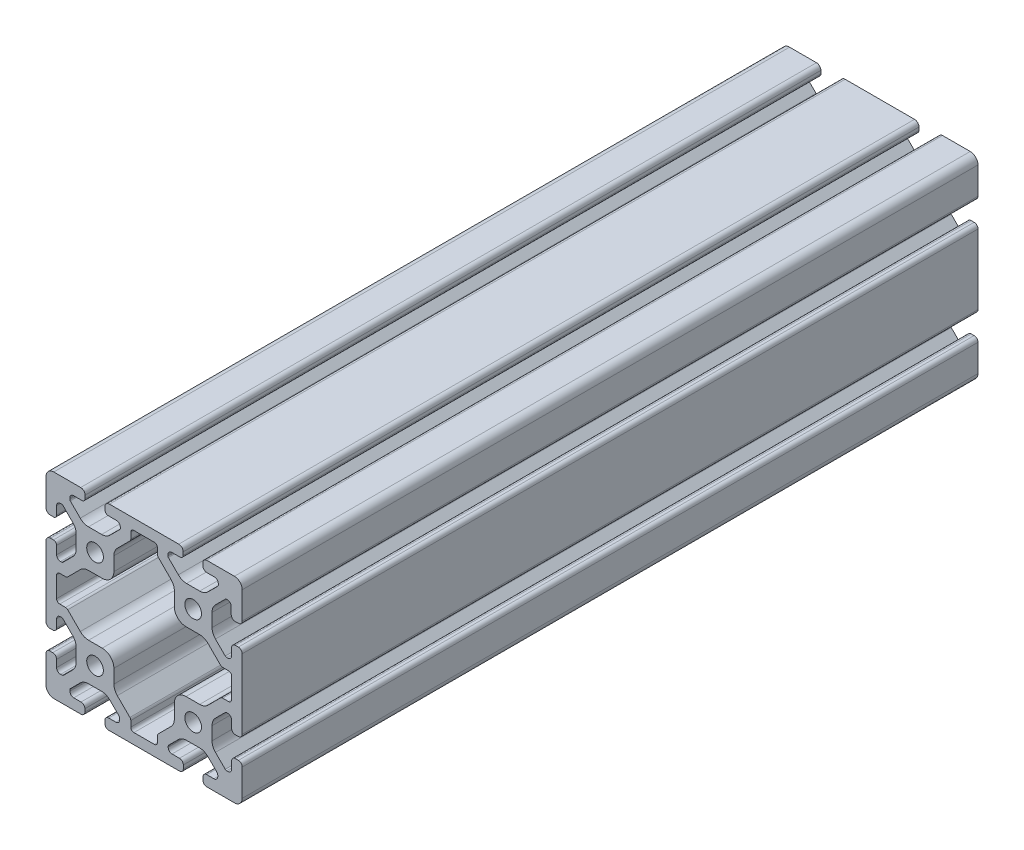
from build123d import *

# Parameters (mm, degrees)
SKETCH1_R      = 3.4
EXTRUDE1_DEPTH = 300


with BuildPart() as part:
    # Sketch1 → Extrude1 (new body)
    with BuildSketch(Plane.XY):
        with BuildLine():
            Line((29.091242789, 26.036541495), (33.082657296, 30.027956002))
            ThreePointArc((33.082657296, 30.027956002), (33.329219041, 30.192703293), (33.62005845, 30.250554848))
            Line((33.62005845, 30.250554848), (33.955571436, 30.250554848))
            ThreePointArc((33.955571436, 30.250554848), (35.065729082, 29.790712494), (35.525571436, 28.680554848))
            Line((35.525571436, 28.680554848), (35.525571436, 25.777866899))
            ThreePointArc((35.525571436, 25.777866899), (35.985413789, 24.667709253), (37.095571436, 24.207866899))
            Line((37.095571436, 24.207866899), (38.43, 24.207866899))
            ThreePointArc((38.43, 24.207866899), (39.540157646, 24.667709253), (40, 25.777866899))
            Line((40, 25.777866899), (40, 32.933852749))
            Line((40, 32.933852749), (40, 36.83))
            ThreePointArc((40, 36.83), (39.071528496, 39.071528496), (36.83, 40))
            Line((36.83, 40), (25.540851266, 40))
            ThreePointArc((25.540851266, 40), (24.43069362, 39.540157646), (23.970851266, 38.43))
            Line((23.970851266, 38.43), (23.970851266, 37.249043598))
            ThreePointArc((23.970851266, 37.249043598), (24.43069362, 36.138885952), (25.540851266, 35.679043598))
            Line((25.540851266, 35.679043598), (28.625762638, 35.679043598))
            ThreePointArc((28.625762638, 35.679043598), (29.77116849, 35.239363487), (30.250554848, 34.11))
            Line((30.250554848, 34.11), (30.250554848, 33.62005845))
            ThreePointArc((30.250554848, 33.62005845), (30.192703293, 33.329219041), (30.027956002, 33.082657296))
            Line((30.027956002, 33.082657296), (26.036541495, 29.091242789))
            ThreePointArc((26.036541495, 29.091242789), (24.495530588, 28.061572221), (22.677784284, 27.7))
            Line((22.677784284, 27.7), (17.322215716, 27.7))
            ThreePointArc((17.322215716, 27.7), (15.504469412, 28.061572221), (13.963458505, 29.091242789))
            Line((13.963458505, 29.091242789), (9.90393336, 33.150767934))
            ThreePointArc((9.90393336, 33.150767934), (9.764102181, 33.360040084), (9.715, 33.606893415))
            Line((9.715, 33.606893415), (9.715, 34.096834965))
            ThreePointArc((9.715, 34.096834965), (10.178698303, 35.216301697), (11.298165035, 35.68))
            Line((11.298165035, 35.68), (14.642754087, 35.68))
            ThreePointArc((14.642754087, 35.68), (15.560045469, 36.059954531), (15.94, 36.977245913))
            Line((15.94, 36.977245913), (15.94, 38.194841282))
            ThreePointArc((15.94, 38.194841282), (15.411281253, 39.471281253), (14.134841282, 40))
            Line((14.134841282, 40), (6.984433948, 40))
            Line((6.984433948, 40), (-6.984433948, 40))
            Line((-6.984433948, 40), (-14.134841282, 40))
            ThreePointArc((-14.134841282, 40), (-15.411281253, 39.471281253), (-15.94, 38.194841282))
            Line((-15.94, 38.194841282), (-15.94, 36.977245913))
            ThreePointArc((-15.94, 36.977245913), (-15.560045469, 36.059954531), (-14.642754087, 35.68))
            Line((-14.642754087, 35.68), (-11.298165035, 35.68))
            ThreePointArc((-11.298165035, 35.68), (-10.178698303, 35.216301697), (-9.715, 34.096834965))
            Line((-9.715, 34.096834965), (-9.715, 33.606893415))
            ThreePointArc((-9.715, 33.606893415), (-9.764102181, 33.360040084), (-9.90393336, 33.150767934))
            Line((-9.90393336, 33.150767934), (-13.963458505, 29.091242789))
            ThreePointArc((-13.963458505, 29.091242789), (-15.504469412, 28.061572221), (-17.322215716, 27.7))
            Line((-17.322215716, 27.7), (-22.677784284, 27.7))
            ThreePointArc((-22.677784284, 27.7), (-24.495530588, 28.061572221), (-26.036541495, 29.091242789))
            Line((-26.036541495, 29.091242789), (-30.09606664, 33.150767934))
            ThreePointArc((-30.09606664, 33.150767934), (-30.235897819, 33.360040084), (-30.285, 33.606893415))
            Line((-30.285, 33.606893415), (-30.285, 34.096834965))
            ThreePointArc((-30.285, 34.096834965), (-29.821301697, 35.216301697), (-28.701834965, 35.68))
            Line((-28.701834965, 35.68), (-25.357245913, 35.68))
            ThreePointArc((-25.357245913, 35.68), (-24.439954531, 36.059954531), (-24.06, 36.977245913))
            Line((-24.06, 36.977245913), (-24.06, 38.194841282))
            ThreePointArc((-24.06, 38.194841282), (-24.588718747, 39.471281253), (-25.865158718, 40))
            Line((-25.865158718, 40), (-33.031395847, 40))
            Line((-33.031395847, 40), (-36.83, 40))
            ThreePointArc((-36.83, 40), (-39.071528496, 39.071528496), (-40, 36.83))
            Line((-40, 36.83), (-40, 33.318079463))
            Line((-40, 33.318079463), (-40, 25.865158718))
            ThreePointArc((-40, 25.865158718), (-39.471281253, 24.588718747), (-38.194841282, 24.06))
            Line((-38.194841282, 24.06), (-36.977245913, 24.06))
            ThreePointArc((-36.977245913, 24.06), (-36.059954531, 24.439954531), (-35.68, 25.357245913))
            Line((-35.68, 25.357245913), (-35.68, 28.680554848))
            ThreePointArc((-35.68, 28.680554848), (-35.220157646, 29.790712494), (-34.11, 30.250554848))
            Line((-34.11, 30.250554848), (-33.62005845, 30.250554848))
            ThreePointArc((-33.62005845, 30.250554848), (-33.329219041, 30.192703293), (-33.082657296, 30.027956002))
            Line((-33.082657296, 30.027956002), (-29.091242789, 26.036541495))
            ThreePointArc((-29.091242789, 26.036541495), (-28.061572221, 24.495530588), (-27.7, 22.677784284))
            Line((-27.7, 22.677784284), (-27.7, 17.322215716))
            ThreePointArc((-27.7, 17.322215716), (-28.061572221, 15.504469412), (-29.091242789, 13.963458505))
            Line((-29.091242789, 13.963458505), (-33.082657296, 9.972043998))
            ThreePointArc((-33.082657296, 9.972043998), (-33.329219041, 9.807296707), (-33.62005845, 9.749445152))
            Line((-33.62005845, 9.749445152), (-34.11, 9.749445152))
            ThreePointArc((-34.11, 9.749445152), (-35.220157646, 10.209287506), (-35.68, 11.319445152))
            Line((-35.68, 11.319445152), (-35.68, 14.642754087))
            ThreePointArc((-35.68, 14.642754087), (-36.059954531, 15.560045469), (-36.977245913, 15.94))
            Line((-36.977245913, 15.94), (-38.194841282, 15.94))
            ThreePointArc((-38.194841282, 15.94), (-39.471281253, 15.411281253), (-40, 14.134841282))
            Line((-40, 14.134841282), (-40, 7.016888977))
            Line((-40, 7.016888977), (-40, -7.016888977))
            Line((-40, -7.016888977), (-40, -14.447338303))
            ThreePointArc((-40, -14.447338303), (-39.540157646, -15.557495949), (-38.43, -16.017338303))
            Line((-38.43, -16.017338303), (-37.25, -16.017338303))
            ThreePointArc((-37.25, -16.017338303), (-36.139842354, -15.557495949), (-35.68, -14.447338303))
            Line((-35.68, -14.447338303), (-35.68, -11.319445152))
            ThreePointArc((-35.68, -11.319445152), (-35.220157646, -10.209287506), (-34.11, -9.749445152))
            Line((-34.11, -9.749445152), (-33.62005845, -9.749445152))
            ThreePointArc((-33.62005845, -9.749445152), (-33.329219041, -9.807296707), (-33.082657296, -9.972043998))
            Line((-33.082657296, -9.972043998), (-29.091242789, -13.963458505))
            ThreePointArc((-29.091242789, -13.963458505), (-28.061572221, -15.504469412), (-27.7, -17.322215716))
            Line((-27.7, -17.322215716), (-27.7, -22.677784284))
            ThreePointArc((-27.7, -22.677784284), (-28.061572221, -24.495530588), (-29.091242789, -26.036541495))
            Line((-29.091242789, -26.036541495), (-32.871776968, -29.817075674))
            ThreePointArc((-32.871776968, -29.817075674), (-33.10612883, -29.976640176), (-33.382654504, -30.039211548))
            Line((-33.382654504, -30.039211548), (-34.05520779, -30.062697627))
            ThreePointArc((-34.05520779, -30.062697627), (-35.200613642, -29.623017515), (-35.68, -28.493654028))
            Line((-35.68, -28.493654028), (-35.68, -25.59096608))
            ThreePointArc((-35.68, -25.59096608), (-36.139842354, -24.480808433), (-37.25, -24.02096608))
            Line((-37.25, -24.02096608), (-38.43, -24.02096608))
            ThreePointArc((-38.43, -24.02096608), (-39.540157646, -24.480808433), (-40, -25.59096608))
            Line((-40, -25.59096608), (-40, -33.019082273))
            Line((-40, -33.019082273), (-40, -36.83))
            ThreePointArc((-40, -36.83), (-39.071528496, -39.071528496), (-36.83, -40))
            Line((-36.83, -40), (-33, -40))
            Line((-33, -40), (-25.72307469, -40))
            ThreePointArc((-25.72307469, -40), (-24.612917043, -39.540157646), (-24.15307469, -38.43))
            Line((-24.15307469, -38.43), (-24.15307469, -37.25))
            ThreePointArc((-24.15307469, -37.25), (-24.612917043, -36.139842354), (-25.72307469, -35.68))
            Line((-25.72307469, -35.68), (-28.680554848, -35.68))
            ThreePointArc((-28.680554848, -35.68), (-29.790712494, -35.220157646), (-30.250554848, -34.11))
            Line((-30.250554848, -34.11), (-30.250554848, -33.62005845))
            ThreePointArc((-30.250554848, -33.62005845), (-30.192703293, -33.329219041), (-30.027956002, -33.082657296))
            Line((-30.027956002, -33.082657296), (-26.036541495, -29.091242789))
            ThreePointArc((-26.036541495, -29.091242789), (-24.495530588, -28.061572221), (-22.677784284, -27.7))
            Line((-22.677784284, -27.7), (-17.322215716, -27.7))
            ThreePointArc((-17.322215716, -27.7), (-15.504469412, -28.061572221), (-13.963458505, -29.091242789))
            Line((-13.963458505, -29.091242789), (-10.203784275, -32.85091702))
            ThreePointArc((-10.203784275, -32.85091702), (-10.044219772, -33.085268882), (-9.9816484, -33.361794556))
            Line((-9.9816484, -33.361794556), (-9.957433876, -34.05520779))
            ThreePointArc((-9.957433876, -34.05520779), (-10.397113988, -35.200613642), (-11.526477474, -35.68))
            Line((-11.526477474, -35.68), (-14.429165423, -35.68))
            ThreePointArc((-14.429165423, -35.68), (-15.539323069, -36.139842354), (-15.999165423, -37.25))
            Line((-15.999165423, -37.25), (-15.999165423, -38.43))
            ThreePointArc((-15.999165423, -38.43), (-15.539323069, -39.540157646), (-14.429165423, -40))
            Line((-14.429165423, -40), (-6.998716097, -40))
            Line((-6.998716097, -40), (6.998716097, -40))
            Line((6.998716097, -40), (14.424638994, -40))
            ThreePointArc((14.424638994, -40), (15.53479664, -39.540157646), (15.994638994, -38.43))
            Line((15.994638994, -38.43), (15.994638994, -37.032644306))
            ThreePointArc((15.994638994, -37.032644306), (15.53479664, -35.922486659), (14.424638994, -35.462644306))
            Line((14.424638994, -35.462644306), (11.382372282, -35.462644306))
            ThreePointArc((11.382372282, -35.462644306), (10.272214636, -35.002801952), (9.812372282, -33.892644306))
            Line((9.812372282, -33.892644306), (9.812372282, -33.55713132))
            ThreePointArc((9.812372282, -33.55713132), (9.870223837, -33.266291912), (10.034971128, -33.019730166))
            Line((10.034971128, -33.019730166), (13.963458505, -29.091242789))
            ThreePointArc((13.963458505, -29.091242789), (15.504469412, -28.061572221), (17.322215716, -27.7))
            Line((17.322215716, -27.7), (22.677784284, -27.7))
            ThreePointArc((22.677784284, -27.7), (24.495530588, -28.061572221), (26.036541495, -29.091242789))
            Line((26.036541495, -29.091242789), (29.794925243, -32.849626538))
            ThreePointArc((29.794925243, -32.849626538), (29.954489746, -33.083978399), (30.017061118, -33.360504074))
            Line((30.017061118, -33.360504074), (30.041320706, -34.05520779))
            ThreePointArc((30.041320706, -34.05520779), (29.601640594, -35.200613642), (28.472277108, -35.68))
            Line((28.472277108, -35.68), (25.569589159, -35.68))
            ThreePointArc((25.569589159, -35.68), (24.459431513, -36.139842354), (23.999589159, -37.25))
            Line((23.999589159, -37.25), (23.999589159, -38.43))
            ThreePointArc((23.999589159, -38.43), (24.459431513, -39.540157646), (25.569589159, -40))
            Line((25.569589159, -40), (32.999849358, -40))
            Line((32.999849358, -40), (36.83, -40))
            ThreePointArc((36.83, -40), (39.071528496, -39.071528496), (40, -36.83))
            Line((40, -36.83), (40, -33.025941835))
            Line((40, -33.025941835), (40, -25.777866899))
            ThreePointArc((40, -25.777866899), (39.540157646, -24.667709253), (38.43, -24.207866899))
            Line((38.43, -24.207866899), (37.25, -24.207866899))
            ThreePointArc((37.25, -24.207866899), (36.139842354, -24.667709253), (35.68, -25.777866899))
            Line((35.68, -25.777866899), (35.68, -28.680554848))
            ThreePointArc((35.68, -28.680554848), (35.220157646, -29.790712494), (34.11, -30.250554848))
            Line((34.11, -30.250554848), (33.62005845, -30.250554848))
            ThreePointArc((33.62005845, -30.250554848), (33.329219041, -30.192703293), (33.082657296, -30.027956002))
            Line((33.082657296, -30.027956002), (29.091242789, -26.036541495))
            ThreePointArc((29.091242789, -26.036541495), (28.061572221, -24.495530588), (27.7, -22.677784284))
            Line((27.7, -22.677784284), (27.7, -17.322215716))
            ThreePointArc((27.7, -17.322215716), (28.061572221, -15.504469412), (29.091242789, -13.963458505))
            Line((29.091242789, -13.963458505), (33.082657296, -9.972043998))
            ThreePointArc((33.082657296, -9.972043998), (33.329219041, -9.807296707), (33.62005845, -9.749445152))
            Line((33.62005845, -9.749445152), (34.11, -9.749445152))
            ThreePointArc((34.11, -9.749445152), (35.220157646, -10.209287506), (35.68, -11.319445152))
            Line((35.68, -11.319445152), (35.68, -14.222133101))
            ThreePointArc((35.68, -14.222133101), (36.139842354, -15.332290747), (37.25, -15.792133101))
            Line((37.25, -15.792133101), (38.43, -15.792133101))
            ThreePointArc((38.43, -15.792133101), (39.540157646, -15.332290747), (40, -14.222133101))
            Line((40, -14.222133101), (40, -7.021415406))
            Line((40, -7.021415406), (40, 7.021415406))
            Line((40, 7.021415406), (40, 14.222133101))
            ThreePointArc((40, 14.222133101), (39.540157646, 15.332290747), (38.43, 15.792133101))
            Line((38.43, 15.792133101), (37.25, 15.792133101))
            ThreePointArc((37.25, 15.792133101), (36.139842354, 15.332290747), (35.68, 14.222133101))
            Line((35.68, 14.222133101), (35.68, 11.319445152))
            ThreePointArc((35.68, 11.319445152), (35.220157646, 10.209287506), (34.11, 9.749445152))
            Line((34.11, 9.749445152), (33.62005845, 9.749445152))
            ThreePointArc((33.62005845, 9.749445152), (33.329219041, 9.807296707), (33.082657296, 9.972043998))
            Line((33.082657296, 9.972043998), (29.091242789, 13.963458505))
            ThreePointArc((29.091242789, 13.963458505), (28.061572221, 15.504469412), (27.7, 17.322215716))
            Line((27.7, 17.322215716), (27.7, 22.677784284))
            ThreePointArc((27.7, 22.677784284), (28.061572221, 24.495530588), (29.091242789, 26.036541495))
        make_face()
        with Locations((-20, 20)):
            Circle(SKETCH1_R, mode=Mode.SUBTRACT)
        with Locations((20, 20)):
            Circle(SKETCH1_R, mode=Mode.SUBTRACT)
        with Locations((20, -20)):
            Circle(SKETCH1_R, mode=Mode.SUBTRACT)
        with Locations((-20, -20)):
            Circle(SKETCH1_R, mode=Mode.SUBTRACT)
        with BuildLine():
            Line((17.07, 12.32), (22.657784284, 12.32))
            ThreePointArc((22.657784284, 12.32), (24.475530588, 11.958427779), (26.016541495, 10.928757211))
            Line((26.016541495, 10.928757211), (31.143879165, 5.80141954))
            ThreePointArc((31.143879165, 5.80141954), (31.555896818, 5.526118146), (32.041904777, 5.429445152))
            Line((32.041904777, 5.429445152), (34.41, 5.429445152))
            ThreePointArc((34.41, 5.429445152), (35.308025612, 5.057470764), (35.68, 4.159445152))
            Line((35.68, 4.159445152), (35.68, -4.159445152))
            ThreePointArc((35.68, -4.159445152), (35.308025612, -5.057470764), (34.41, -5.429445152))
            Line((34.41, -5.429445152), (32.041904777, -5.429445152))
            ThreePointArc((32.041904777, -5.429445152), (31.555896818, -5.526118146), (31.143879165, -5.80141954))
            Line((31.143879165, -5.80141954), (26.016541495, -10.928757211))
            ThreePointArc((26.016541495, -10.928757211), (24.475530588, -11.958427779), (22.657784284, -12.32))
            Line((22.657784284, -12.32), (17.07, -12.32))
            ThreePointArc((17.07, -12.32), (13.711242789, -13.711242789), (12.32, -17.07))
            Line((12.32, -17.07), (12.32, -22.657784284))
            ThreePointArc((12.32, -22.657784284), (11.958427779, -24.475530588), (10.928757211, -26.016541495))
            Line((10.928757211, -26.016541495), (5.80141954, -31.143879165))
            ThreePointArc((5.80141954, -31.143879165), (5.526118146, -31.555896818), (5.429445152, -32.041904777))
            Line((5.429445152, -32.041904777), (5.429445152, -34.41))
            ThreePointArc((5.429445152, -34.41), (5.057470764, -35.308025612), (4.159445152, -35.68))
            Line((4.159445152, -35.68), (-4.159445152, -35.68))
            ThreePointArc((-4.159445152, -35.68), (-5.057470764, -35.308025612), (-5.429445152, -34.41))
            Line((-5.429445152, -34.41), (-5.429445152, -32.041904777))
            ThreePointArc((-5.429445152, -32.041904777), (-5.526118146, -31.555896818), (-5.80141954, -31.143879165))
            Line((-5.80141954, -31.143879165), (-10.928757211, -26.016541495))
            ThreePointArc((-10.928757211, -26.016541495), (-11.958427779, -24.475530588), (-12.32, -22.657784284))
            Line((-12.32, -22.657784284), (-12.32, -17.07))
            ThreePointArc((-12.32, -17.07), (-13.711242789, -13.711242789), (-17.07, -12.32))
            Line((-17.07, -12.32), (-22.657784284, -12.32))
            ThreePointArc((-22.657784284, -12.32), (-24.475530588, -11.958427779), (-26.016541495, -10.928757211))
            Line((-26.016541495, -10.928757211), (-31.143879165, -5.80141954))
            ThreePointArc((-31.143879165, -5.80141954), (-31.555896818, -5.526118146), (-32.041904777, -5.429445152))
            Line((-32.041904777, -5.429445152), (-34.41, -5.429445152))
            ThreePointArc((-34.41, -5.429445152), (-35.308025612, -5.057470764), (-35.68, -4.159445152))
            Line((-35.68, -4.159445152), (-35.68, 4.159445152))
            ThreePointArc((-35.68, 4.159445152), (-35.308025612, 5.057470764), (-34.41, 5.429445152))
            Line((-34.41, 5.429445152), (-32.041904777, 5.429445152))
            ThreePointArc((-32.041904777, 5.429445152), (-31.555896818, 5.526118146), (-31.143879165, 5.80141954))
            Line((-31.143879165, 5.80141954), (-26.016541495, 10.928757211))
            ThreePointArc((-26.016541495, 10.928757211), (-24.475530588, 11.958427779), (-22.657784284, 12.32))
            Line((-22.657784284, 12.32), (-17.07, 12.32))
            ThreePointArc((-17.07, 12.32), (-13.711242789, 13.711242789), (-12.32, 17.07))
            Line((-12.32, 17.07), (-12.32, 22.657784284))
            ThreePointArc((-12.32, 22.657784284), (-11.958427779, 24.475530588), (-10.928757211, 26.016541495))
            Line((-10.928757211, 26.016541495), (-5.80141954, 31.143879165))
            ThreePointArc((-5.80141954, 31.143879165), (-5.526118146, 31.555896818), (-5.429445152, 32.041904777))
            Line((-5.429445152, 32.041904777), (-5.429445152, 34.41))
            ThreePointArc((-5.429445152, 34.41), (-5.057470764, 35.308025612), (-4.159445152, 35.68))
            Line((-4.159445152, 35.68), (4.159445152, 35.68))
            ThreePointArc((4.159445152, 35.68), (5.057470764, 35.308025612), (5.429445152, 34.41))
            Line((5.429445152, 34.41), (5.429445152, 32.041904777))
            ThreePointArc((5.429445152, 32.041904777), (5.526118146, 31.555896818), (5.80141954, 31.143879165))
            Line((5.80141954, 31.143879165), (10.928757211, 26.016541495))
            ThreePointArc((10.928757211, 26.016541495), (11.958427779, 24.475530588), (12.32, 22.657784284))
            Line((12.32, 22.657784284), (12.32, 17.07))
            ThreePointArc((12.32, 17.07), (13.711242789, 13.711242789), (17.07, 12.32))
        make_face(mode=Mode.SUBTRACT)
    extrude(amount=-EXTRUDE1_DEPTH)


solid = part.part
